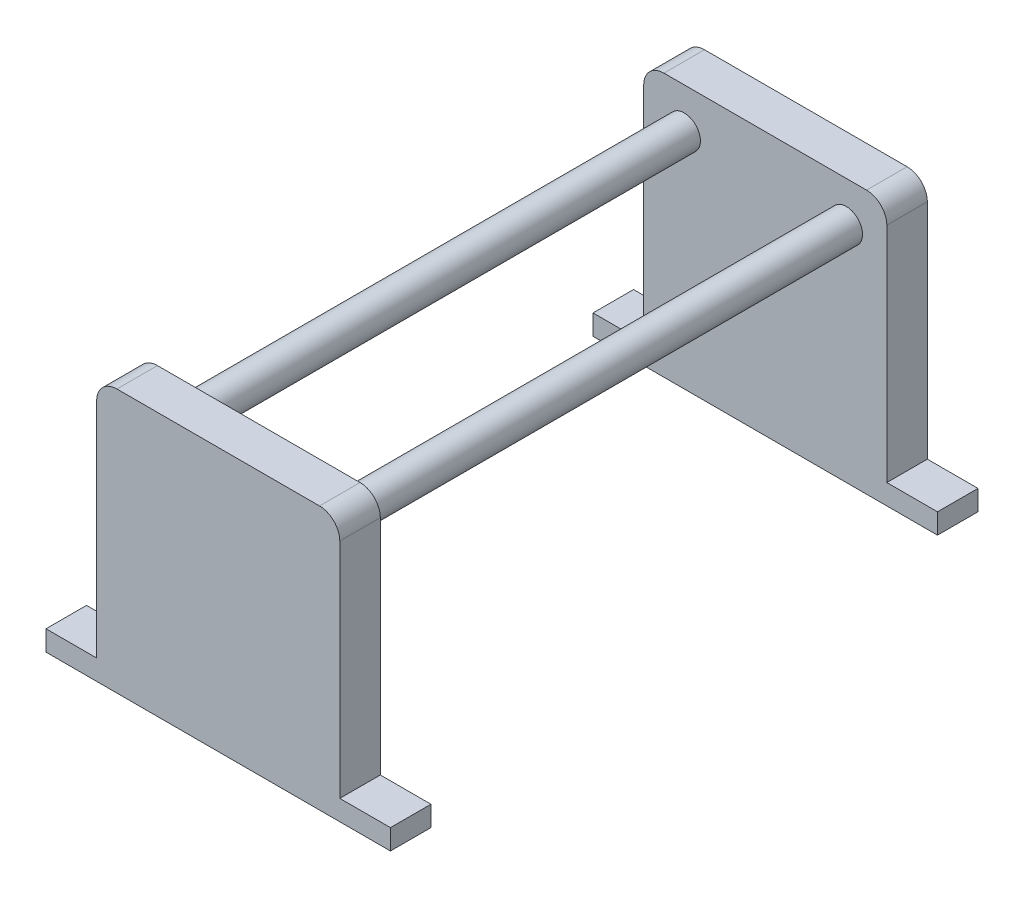
from build123d import *

# Parameters (mm, degrees)
CROQUIS1_W              = 60
CROQUIS1_H              = 60
SALIENTE_EXTRUIR1_DEPTH = 10
REDONDEO1_R             = 5
CROQUIS2_R              = 4
SALIENTE_EXTRUIR2_DEPTH = 125
CROQUIS3_W              = 60
CROQUIS3_H              = 60
CROQUIS3_R              = 4
SALIENTE_EXTRUIR4_DEPTH = 10
REDONDEO2_R             = 5


with BuildPart() as part:
    # Croquis1 → Saliente-Extruir1 (new body)
    with BuildSketch(Plane.XY):
        Rectangle(CROQUIS1_W, CROQUIS1_H)
        Polygon((42.5, -30), (30, -30), (-30, -30), (-42.5, -30), (-42.5, -35), (42.5, -35), align=None)
    extrude(amount=SALIENTE_EXTRUIR1_DEPTH)

    # Redondeo1
    redondeo1_edges = [part.edges().sort_by_distance(p)[0] for p in [
        (30, 30, 5),
        (-30, 30, 5),
    ]]
    fillet(redondeo1_edges, radius=REDONDEO1_R)

    # Croquis2 → Saliente-Extruir2 (add)
    with BuildSketch(Plane(origin=(0, 0, 0), x_dir=(-1, 0, 0), z_dir=(0, 0, -1))):
        with Locations(Location((-20, 20, 0), (0, 0, 180))):
            Circle(CROQUIS2_R)
        with Locations(Location((20, 20, 0), (0, 0, 180))):
            Circle(CROQUIS2_R)
    extrude(amount=SALIENTE_EXTRUIR2_DEPTH)

    # Croquis3 → Saliente-Extruir4 (add)
    # profile 1 of 3: a face of its own
    with BuildSketch(Plane(origin=(0, 0, -125), x_dir=(-1, 0, 0), z_dir=(0, 0, -1))):
        Rectangle(CROQUIS3_W, CROQUIS3_H)
        with Locations(Location((20, 20, 0), (0, 0, 180))):
            Circle(CROQUIS3_R, mode=Mode.SUBTRACT)
    # profile 2 of 3: a face of its own
    with BuildSketch(Plane(origin=(0, 0, -125), x_dir=(-1, 0, 0), z_dir=(0, 0, -1))):
        Polygon((30, -30), (-30, -30), (-42.5, -30), (-42.5, -35), (42.5, -35), (42.5, -30), align=None)
    # profile 3 of 3: a face of its own
    with BuildSketch(Plane(origin=(0, 0, -125), x_dir=(-1, 0, 0), z_dir=(0, 0, -1))):
        with Locations(Location((20, 20, 0), (0, 0, 180))):
            Circle(CROQUIS3_R)
    extrude(amount=SALIENTE_EXTRUIR4_DEPTH)

    # Redondeo2
    redondeo2_edges = [part.edges().sort_by_distance(p)[0] for p in [
        (-30, 30, -130),
        (30, 30, -130),
    ]]
    fillet(redondeo2_edges, radius=REDONDEO2_R)


solid = part.part
